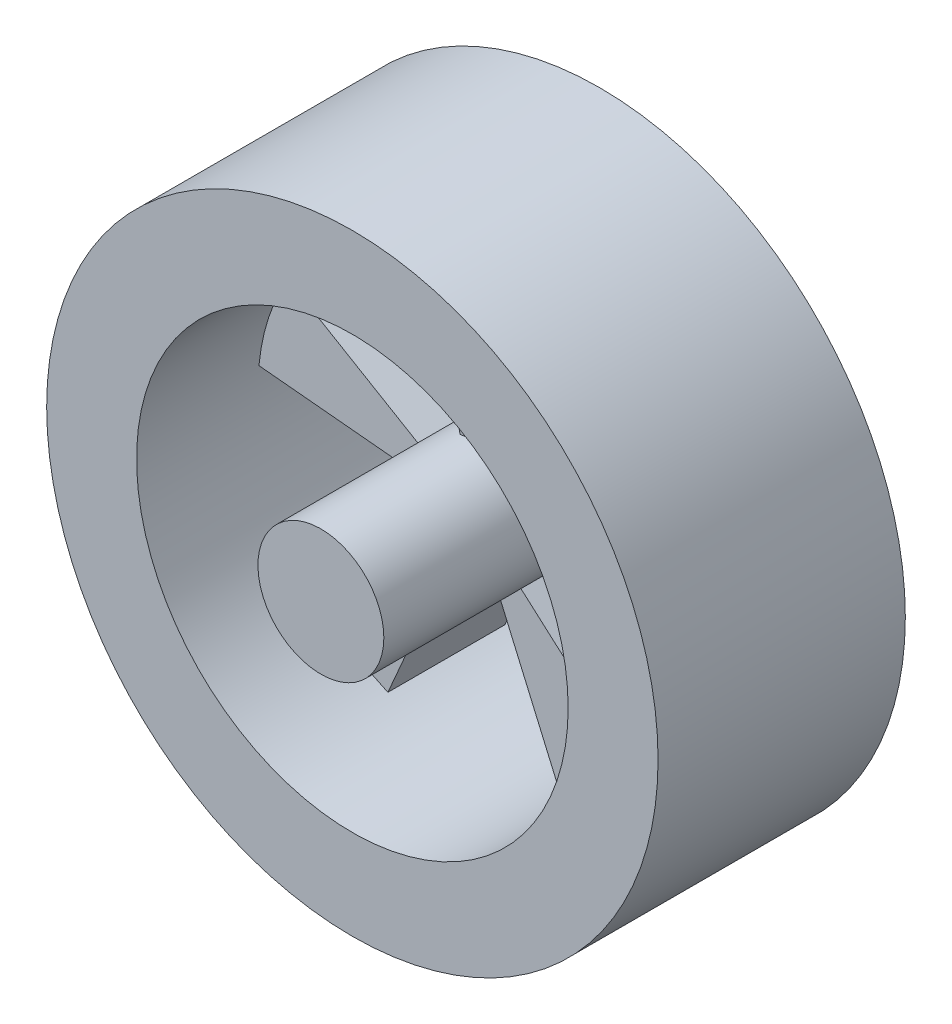
from build123d import *

# Parameters (mm, degrees)
SALIENTE_EXTRUIR2_DEPTH      = 26.5
SALIENTE_EXTRUIR2_DEPTH_BACK = 1
CROQUIS1_R                   = 34
CROQUIS1_R_2                 = 24
CROQUIS2_R                   = 7
SALIENTE_EXTRUIR3_DEPTH      = 30
SALIENTE_EXTRUIR4_DEPTH      = 13


with BuildPart() as part:
    # Croquis1 → Saliente-Extruir2 (new, two sides: drawn at the far end of the back side and taken through both)
    with BuildSketch(Plane.XY.offset(-SALIENTE_EXTRUIR2_DEPTH_BACK)):
        Circle(CROQUIS1_R)
        Circle(CROQUIS1_R_2, mode=Mode.SUBTRACT)
    extrude(amount=SALIENTE_EXTRUIR2_DEPTH + SALIENTE_EXTRUIR2_DEPTH_BACK)



with BuildPart() as body_2:
    # Croquis2 → Saliente-Extruir3 (new body)
    with BuildSketch(Plane.XY):
        Circle(CROQUIS2_R)
    extrude(amount=SALIENTE_EXTRUIR3_DEPTH)


with BuildPart() as part_1:
    add(part.part)

    add(body_2.part)  # Saliente-Extruir4 merges body 2
    # Croquis3 → Saliente-Extruir4 (add)
    with BuildSketch(Plane.XY):
        with BuildLine():
            ThreePointArc((5.215852398, 23.426371545), (0, 24), (-5.215852398, 23.426371545))
            Line((-5.215852398, 23.426371545), (0, 0))
            Line((0, 0), (5.215852398, 23.426371545))
        make_face()
        with BuildLine():
            Line((-23.891590342, 2.278576513), (0, 0))
            Line((0, 0), (-20.66801628, 12.199717335))
            ThreePointArc((-20.66801628, 12.199717335), (-22.825356391, 7.416407865), (-23.891590342, 2.278576513))
        make_face()
        with BuildLine():
            Line((20.66801628, 12.199717335), (0, 0))
            Line((0, 0), (23.891590342, 2.278576513))
            ThreePointArc((23.891590342, 2.278576513), (22.825356391, 7.416407865), (20.66801628, 12.199717335))
        make_face()
        with BuildLine():
            Line((17.989388939, -15.886531579), (0, 0))
            Line((0, 0), (9.549962479, -22.018133814))
            ThreePointArc((9.549962479, -22.018133814), (14.106846055, -19.416407865), (17.989388939, -15.886531579))
        make_face()
        with BuildLine():
            Line((-9.549962479, -22.018133814), (0, 0))
            Line((0, 0), (-17.989388939, -15.886531579))
            ThreePointArc((-17.989388939, -15.886531579), (-14.106846055, -19.416407865), (-9.549962479, -22.018133814))
        make_face()
    extrude(amount=SALIENTE_EXTRUIR4_DEPTH)


solid = part_1.part
